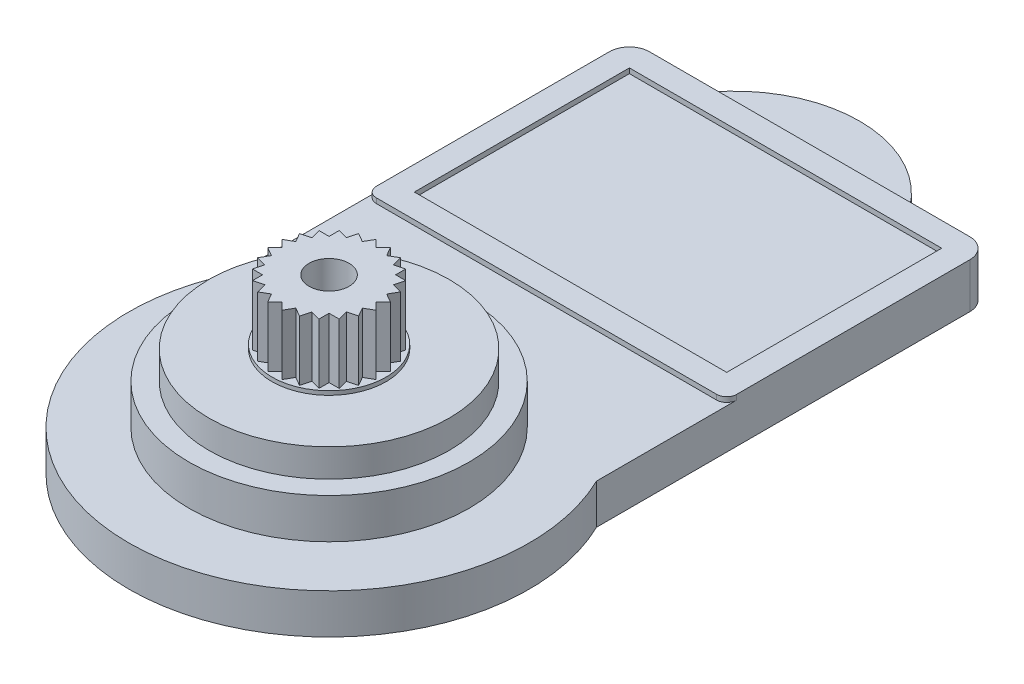
from build123d import *

# Parameters (mm, degrees)
SKETCH1_R           = 10
SKETCH1_R_2         = 1
BOSS_EXTRUDE1_DEPTH = 2
BOSS_EXTRUDE2_DEPTH = 0.25
SKETCH3_W           = 15.6
SKETCH3_H           = 10.74
CUT_EXTRUDE1_DEPTH  = 0.25
SKETCH4_R           = 7
BOSS_EXTRUDE3_DEPTH = 2
SKETCH5_R           = 6
BOSS_EXTRUDE4_DEPTH = 1.4
SKETCH6_R           = 2.85
BOSS_EXTRUDE5_DEPTH = 0.2
BOSS_EXTRUDE6_DEPTH = 3
SKETCH10_R          = 1
CUT_EXTRUDE4_DEPTH  = 3


with BuildPart() as part:
    # Sketch1 → Boss-Extrude1 (new body)
    with BuildSketch(Plane(origin=(0, 0, 0), x_dir=(1, 0, 0), z_dir=(0, 1, 0))):
        with Locations((0, -10.95)):
            Circle(SKETCH1_R)
        with BuildLine():
            Line((-9, -15.308898944), (-9, -6.591101056))
            ThreePointArc((-9, -6.591101056), (-10, -10.95), (-9, -15.308898944))
        make_face()
        with BuildLine():
            ThreePointArc((10, -10.95), (9.746794345, -8.713932023), (9, -6.591101056))
            Line((9, -6.591101056), (9, -15.308898944))
            ThreePointArc((9, -15.308898944), (9.746794345, -13.186067977), (10, -10.95))
        make_face()
        with BuildLine():
            Line((7.512655988, -17.55), (-7.512655988, -17.55))
            ThreePointArc((-7.512655988, -17.55), (0, -20.95), (7.512655988, -17.55))
        make_face()
        with BuildLine():
            Line((5, 13.05), (-5, 13.05))
            Line((-5, 13.05), (-8, 13.05))
            ThreePointArc((-8, 13.05), (-7.292893219, 12.757106781), (-7, 12.05))
            ThreePointArc((-7, 12.05), (-8.000000001, 11.05), (-9, 12.050000002))
            Line((-9, 12.050000002), (-9, -6.591101056))
            ThreePointArc((-9, -6.591101056), (0, -0.95), (9, -6.591101056))
            Line((9, -6.591101056), (9, 12.05))
            ThreePointArc((9, 12.05), (7.292893219, 11.342893219), (8, 13.05))
            Line((8, 13.05), (5, 13.05))
        make_face()
        with Locations((-8, 12.05)):
            Circle(SKETCH1_R_2)
        with BuildLine():
            ThreePointArc((5, 13.05), (0, 15.55), (-5, 13.05))
            Line((-5, 13.05), (5, 13.05))
        make_face()
        with Locations((8, 12.05)):
            Circle(SKETCH1_R_2)
    extrude(amount=BOSS_EXTRUDE1_DEPTH)

    # Sketch2 → Boss-Extrude2 (add)
    with BuildSketch(Plane(origin=(0, 2, 0), x_dir=(-1, 0, 0), z_dir=(0, 1, 0))):
        with BuildLine():
            Line((-8.000000002, -13.05), (8, -13.05))
            ThreePointArc((8, -13.05), (8.707106781, -12.757106781), (9, -12.05))
            Line((9, -12.05), (9, -0.41))
            ThreePointArc((9, -0.41), (8.853553391, -0.056446609), (8.5, 0.09))
            Line((8.5, 0.09), (-8.5, 0.09))
            ThreePointArc((-8.5, 0.09), (-8.853553391, -0.056446609), (-9, -0.41))
            Line((-9, -0.41), (-9, -12.05))
            ThreePointArc((-9, -12.05), (-8.707106782, -12.757106781), (-8.000000002, -13.05))
        make_face()
    extrude(amount=BOSS_EXTRUDE2_DEPTH)

    # Sketch3 → Cut-Extrude1 (cut)
    with BuildSketch(Plane(origin=(0, 2.25, 0), x_dir=(-1, 0, 0), z_dir=(0, 1, 0))):
        with Locations((0, -6.48)):
            Rectangle(SKETCH3_W, SKETCH3_H)
    extrude(amount=-CUT_EXTRUDE1_DEPTH, mode=Mode.SUBTRACT)

    # Sketch4 → Boss-Extrude3 (add)
    with BuildSketch(Plane(origin=(0, 2, 0), x_dir=(-1, 0, 0), z_dir=(0, 1, 0))):
        with Locations(Location((0, 10.95, 0), (0, 0, 90))):
            Circle(SKETCH4_R)
    extrude(amount=BOSS_EXTRUDE3_DEPTH)

    # Sketch5 → Boss-Extrude4 (add)
    with BuildSketch(Plane(origin=(0, 4, 0), x_dir=(-1, 0, 0), z_dir=(0, 1, 0))):
        with Locations(Location((0, 10.95, 0), (0, 0, 90))):
            Circle(SKETCH5_R)
    extrude(amount=BOSS_EXTRUDE4_DEPTH)

    # Sketch6 → Boss-Extrude5 (add)
    with BuildSketch(Plane(origin=(0, 5.4, 0), x_dir=(-1, 0, 0), z_dir=(0, 1, 0))):
        with Locations(Location((0, 10.95, 0), (0, 0, 90))):
            Circle(SKETCH6_R)
    extrude(amount=BOSS_EXTRUDE5_DEPTH)

    # Sketch9 → Boss-Extrude6 (add)
    with BuildSketch(Plane(origin=(0, 5.6, 0), x_dir=(-1, 0, 0), z_dir=(0, 1, 0))):
        Polygon((-0.356289813, 8.243710187), (0, 8.6), (0.356289813, 8.243710187), (0.608224756, 8.680074308), (1.044588877, 8.428139365), (1.175, 8.914840301), (1.661700936, 8.784429178), (1.661700936, 9.288299064), (2.165570822, 9.288299064), (2.035159699, 9.775), (2.521860635, 9.905411123), (2.269925692, 10.341775244), (2.706289813, 10.593710187), (2.35, 10.95), (2.706289813, 11.306289813), (2.269925692, 11.558224756), (2.521860635, 11.994588877), (2.035159699, 12.125), (2.165570822, 12.611700936), (1.661700936, 12.611700936), (1.661700936, 13.115570822), (1.175, 12.985159699), (1.044588877, 13.471860635), (0.608224756, 13.219925692), (0.356289813, 13.656289813), (0, 13.3), (-0.356289813, 13.656289813), (-0.608224756, 13.219925692), (-1.044588877, 13.471860635), (-1.175, 12.985159699), (-1.661700936, 13.115570822), (-1.661700936, 12.611700936), (-2.165570822, 12.611700936), (-2.035159699, 12.125), (-2.521860635, 11.994588877), (-2.269925692, 11.558224756), (-2.706289813, 11.306289813), (-2.35, 10.95), (-2.706289813, 10.593710187), (-2.269925692, 10.341775244), (-2.521860635, 9.905411123), (-2.035159699, 9.775), (-2.165570822, 9.288299064), (-1.661700936, 9.288299064), (-1.661700936, 8.784429178), (-1.175, 8.914840301), (-1.044588877, 8.428139365), (-0.608224756, 8.680074308), align=None)
    extrude(amount=BOSS_EXTRUDE6_DEPTH)

    # Sketch10 → Cut-Extrude4 (cut)
    with BuildSketch(Plane(origin=(0, 8.6, 0), x_dir=(-1, 0, 0), z_dir=(0, 1, 0))):
        with Locations(Location((0, 10.95, 0), (0, 0, 90))):
            Circle(SKETCH10_R)
    extrude(amount=-CUT_EXTRUDE4_DEPTH, mode=Mode.SUBTRACT)


solid = part.part
